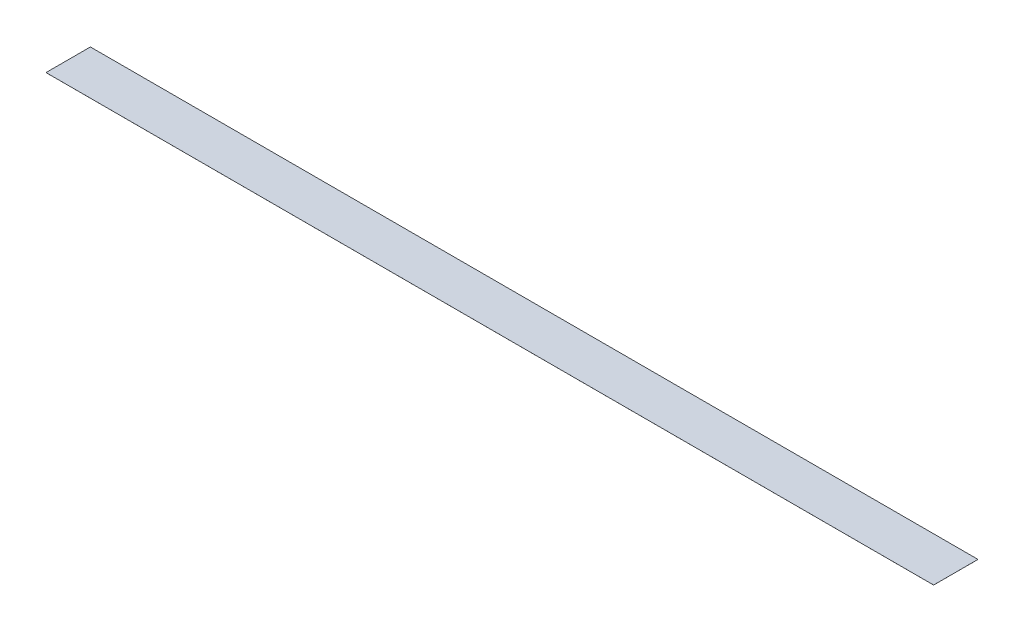
from build123d import *

# Parameters (mm, degrees)
ESBO_O1_W                 = 400
ESBO_O1_H                 = 20
RESSALTO_EXTRUS_O11_DEPTH = 0.01


with BuildPart() as part:
    # Esboço1 → Ressalto-extrusão11 (new body)
    with BuildSketch(Plane(origin=(0, 0, 0), x_dir=(1, 0, 0), z_dir=(0, 1, 0))):
        with Locations((494.276767169, 1077.502840459)):
            Rectangle(ESBO_O1_W, ESBO_O1_H)
    extrude(amount=RESSALTO_EXTRUS_O11_DEPTH)


solid = part.part
